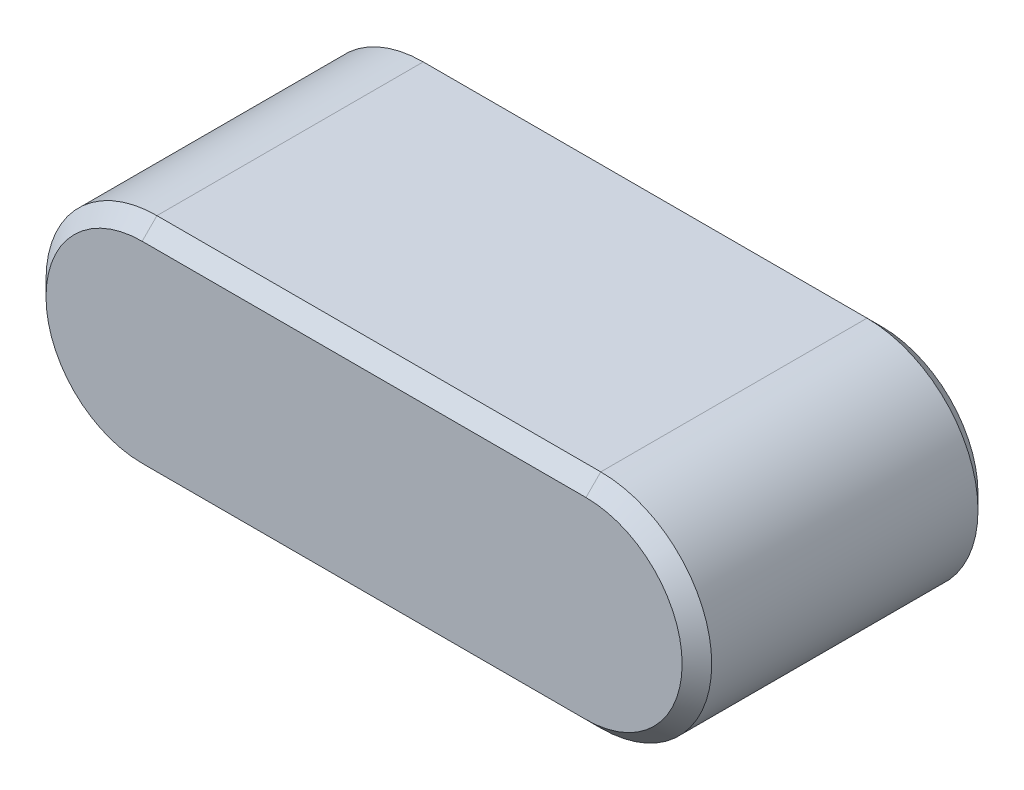
from build123d import *

# Parameters (mm, degrees)
EXTRUDE_1_DEPTH = 4
CHAMFER_1_SIZE  = 0.2


with BuildPart() as part:
    # 草图1 → 凸台-拉伸1 (new body)
    with BuildSketch(Plane.XY):
        with BuildLine():
            Line((-3, 1.5), (3, 1.5))
            ThreePointArc((3, 1.5), (4.5, 0), (3, -1.5))
            Line((3, -1.5), (-3, -1.5))
            ThreePointArc((-3, -1.5), (-4.5, 0), (-3, 1.5))
        make_face()
    extrude(amount=EXTRUDE_1_DEPTH)

    # 倒角1
    chamfer_1_edges = [part.edges().sort_by_distance(p)[0] for p in [
        (0, 1.5, 0),
        (4.5, 0, 0),
        (0, -1.5, 0),
        (-4.5, 0, 0),
        (0, 1.5, 4),
        (4.5, 0, 4),
        (0, -1.5, 4),
        (-4.5, 0, 4),
    ]]
    chamfer(chamfer_1_edges, length=CHAMFER_1_SIZE)


solid = part.part
